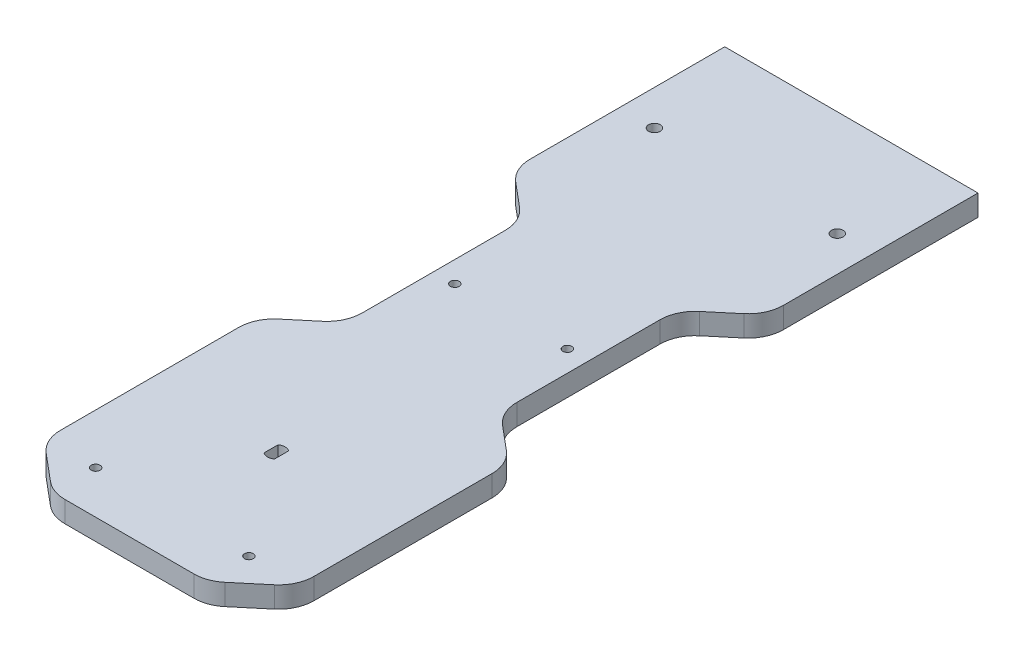
from build123d import *

# Parameters (mm, degrees)
BOSS_EXTRUDE1_DEPTH = 6
FILLET1_R           = 10
SKETCH2_R           = 2.5
CUT_EXTRUDE1_DEPTH  = 6
FILLET2_R           = 10
SKETCH5_R           = 1.25
CUT_EXTRUDE2_DEPTH  = 10
SKETCH6_R           = 1.25
CUT_EXTRUDE3_DEPTH  = 10
SKETCH7_R           = 1.65
CUT_EXTRUDE4_DEPTH  = 10
BOSS_EXTRUDE2_DEPTH = 6


with BuildPart() as part:
    # Sketch1 → Boss-Extrude1 (new body)
    with BuildSketch(Plane(origin=(0, 0, 0), x_dir=(1, 0, 0), z_dir=(0, 1, 0))):
        Polygon((21.213083016, -102.227633762), (35.213083016, -90.480238926), (35.213083016, -30.480238926), (21.213083016, -18.73284409), (21.213083016, 31.26715591), (35.213083016, 43.014550747), (35.213083016, 103.014550747), (-36.786916984, 103.014550747), (-36.786916984, 43.014550747), (-22.786916984, 31.26715591), (-22.786916984, -18.73284409), (-36.786916984, -30.480238926), (-36.786916984, -90.480238926), (-22.786916984, -102.227633762), align=None)
    extrude(amount=BOSS_EXTRUDE1_DEPTH)

    # Fillet1
    fillet1_edges = [part.edges().sort_by_distance(p)[0] for p in [
        (-22.786916984, 3, 102.227633762),
        (-36.786916984, 3, 90.480238926),
        (-36.786916984, 3, 30.480238926),
        (-22.786916984, 3, 18.73284409),
        (21.213083016, 3, 18.73284409),
        (35.213083016, 3, 30.480238926),
        (35.213083016, 3, 90.480238926),
        (21.213083016, 3, 102.227633762),
    ]]
    fillet(fillet1_edges, radius=FILLET1_R)

    # Sketch2 → Cut-Extrude1 (cut)
    with BuildSketch(Plane.XZ):
        with Locations(Location((-0.786916984, 60.480238926, 0), (0, 0, 270))):
            Circle(SKETCH2_R)
    extrude(amount=-CUT_EXTRUDE1_DEPTH, mode=Mode.SUBTRACT)

    # Fillet2
    fillet2_edges = [part.edges().sort_by_distance(p)[0] for p in [
        (-22.786916984, 3, -31.26715591),
        (-36.786916984, 3, -43.014550747),
        (35.213083016, 3, -43.014550747),
        (21.213083016, 3, -31.26715591),
    ]]
    fillet(fillet2_edges, radius=FILLET2_R)

    # Sketch5 → Cut-Extrude2 (cut)
    with BuildSketch(Plane(origin=(0, 6, 0), x_dir=(1, 0, 0), z_dir=(0, 1, 0))):
        with Locations(Location((15.213083016, 6.26715591, 0), (0, 0, 270))):
            Circle(SKETCH5_R)
        with Locations(Location((-16.786916984, 6.26715591, 0), (0, 0, 270))):
            Circle(SKETCH5_R)
    extrude(amount=-CUT_EXTRUDE2_DEPTH, mode=Mode.SUBTRACT)

    # Sketch6 → Cut-Extrude3 (cut)
    with BuildSketch(Plane.XZ):
        with Locations(Location((-22.567416075, 90.043344962, 0), (0, 0, 270))):
            Circle(SKETCH6_R)
        with Locations(Location((20.993582106, 90.043344962, 0), (0, 0, 270))):
            Circle(SKETCH6_R)
    extrude(amount=-CUT_EXTRUDE3_DEPTH, mode=Mode.SUBTRACT)

    # Sketch7 → Cut-Extrude4 (cut)
    with BuildSketch(Plane(origin=(0, 6, 0), x_dir=(1, 0, 0), z_dir=(0, 1, 0))):
        with Locations(Location((25.213083016, 73.014550747, 0), (0, 0, 270))):
            Circle(SKETCH7_R)
        with Locations(Location((-26.786916984, 73.014550747, 0), (0, 0, 270))):
            Circle(SKETCH7_R)
    extrude(amount=-CUT_EXTRUDE4_DEPTH, mode=Mode.SUBTRACT)

    # Sketch8 → Boss-Extrude2 (add)
    with BuildSketch(Plane(origin=(0, 6, 0), x_dir=(1, 0, 0), z_dir=(0, 1, 0))):
        with BuildLine():
            Line((-2.286916984, -57.882162715), (-2.286916984, -63.078315137))
            ThreePointArc((-2.286916984, -63.078315137), (-3.786916984, -60.480238926), (-2.286916984, -57.882162715))
        make_face()
        with BuildLine():
            Line((0.713083016, -57.882162715), (0.713083016, -63.078315137))
            ThreePointArc((0.713083016, -63.078315137), (2.213083016, -60.480238926), (0.713083016, -57.882162715))
        make_face()
    extrude(amount=-BOSS_EXTRUDE2_DEPTH)


solid = part.part
